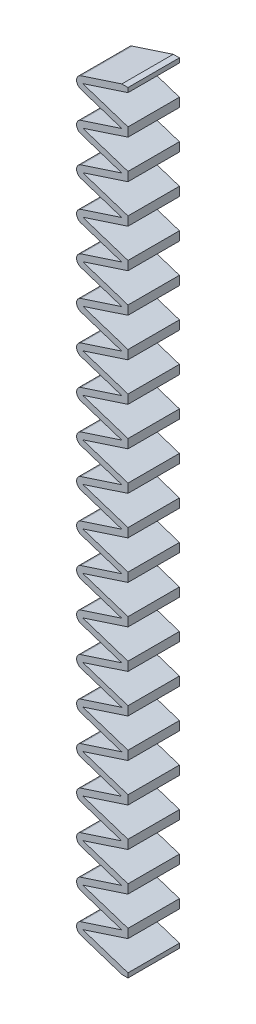
from build123d import *

# Parameters (mm, degrees)
BOSS_EXTRUDE1_DEPTH = 10


with BuildPart() as part:
    # Sketch1 → Boss-Extrude1 (new body)
    with BuildSketch(Plane.XY):
        with BuildLine():
            Line((5, 74.130107274), (5, 75))
            Line((5, 75), (3.8, 75))
            Line((3.8, 75), (-4.17325943, 72.390472445))
            ThreePointArc((-4.17325943, 72.390472445), (-5, 71.25), (-4.17325943, 70.109527555))
            Line((-4.17325943, 70.109527555), (3.8, 67.5))
            Line((3.8, 67.5), (-4.17325943, 64.890472445))
            ThreePointArc((-4.17325943, 64.890472445), (-5, 63.75), (-4.17325943, 62.609527555))
            Line((-4.17325943, 62.609527555), (3.8, 60))
            Line((3.8, 60), (-4.17325943, 57.390472445))
            ThreePointArc((-4.17325943, 57.390472445), (-5, 56.25), (-4.17325943, 55.109527555))
            Line((-4.17325943, 55.109527555), (3.8, 52.5))
            Line((3.8, 52.5), (-4.17325943, 49.890472445))
            ThreePointArc((-4.17325943, 49.890472445), (-5, 48.75), (-4.17325943, 47.609527555))
            Line((-4.17325943, 47.609527555), (3.8, 45))
            Line((3.8, 45), (-4.17325943, 42.390472445))
            ThreePointArc((-4.17325943, 42.390472445), (-5, 41.25), (-4.17325943, 40.109527555))
            Line((-4.17325943, 40.109527555), (3.8, 37.5))
            Line((3.8, 37.5), (-4.17325943, 34.890472445))
            ThreePointArc((-4.17325943, 34.890472445), (-5, 33.75), (-4.17325943, 32.609527555))
            Line((-4.17325943, 32.609527555), (3.8, 30))
            Line((3.8, 30), (-4.17325943, 27.390472445))
            ThreePointArc((-4.17325943, 27.390472445), (-5, 26.25), (-4.17325943, 25.109527555))
            Line((-4.17325943, 25.109527555), (3.8, 22.5))
            Line((3.8, 22.5), (-4.17325943, 19.890472445))
            ThreePointArc((-4.17325943, 19.890472445), (-5, 18.75), (-4.17325943, 17.609527555))
            Line((-4.17325943, 17.609527555), (3.8, 15))
            Line((3.8, 15), (-4.17325943, 12.390472445))
            ThreePointArc((-4.17325943, 12.390472445), (-5, 11.25), (-4.17325943, 10.109527555))
            Line((-4.17325943, 10.109527555), (3.8, 7.5))
            Line((3.8, 7.5), (-4.17325943, 4.890472445))
            ThreePointArc((-4.17325943, 4.890472445), (-5, 3.75), (-4.17325943, 2.609527555))
            Line((-4.17325943, 2.609527555), (3.8, 0))
            Line((3.8, 0), (-4.17325943, -2.609527555))
            ThreePointArc((-4.17325943, -2.609527555), (-5, -3.75), (-4.17325943, -4.890472445))
            Line((-4.17325943, -4.890472445), (3.8, -7.5))
            Line((3.8, -7.5), (-4.17325943, -10.109527555))
            ThreePointArc((-4.17325943, -10.109527555), (-5, -11.25), (-4.17325943, -12.390472445))
            Line((-4.17325943, -12.390472445), (3.8, -15))
            Line((3.8, -15), (-4.17325943, -17.609527555))
            ThreePointArc((-4.17325943, -17.609527555), (-5, -18.75), (-4.17325943, -19.890472445))
            Line((-4.17325943, -19.890472445), (3.8, -22.5))
            Line((3.8, -22.5), (-4.17325943, -25.109527555))
            ThreePointArc((-4.17325943, -25.109527555), (-5, -26.25), (-4.17325943, -27.390472445))
            Line((-4.17325943, -27.390472445), (3.8, -30))
            Line((3.8, -30), (-4.17325943, -32.609527555))
            ThreePointArc((-4.17325943, -32.609527555), (-5, -33.75), (-4.17325943, -34.890472445))
            Line((-4.17325943, -34.890472445), (3.8, -37.5))
            Line((3.8, -37.5), (-4.17325943, -40.109527555))
            ThreePointArc((-4.17325943, -40.109527555), (-5, -41.25), (-4.17325943, -42.390472445))
            Line((-4.17325943, -42.390472445), (3.8, -45))
            Line((3.8, -45), (-4.17325943, -47.609527555))
            ThreePointArc((-4.17325943, -47.609527555), (-5, -48.75), (-4.17325943, -49.890472445))
            Line((-4.17325943, -49.890472445), (3.8, -52.5))
            Line((3.8, -52.5), (-4.17325943, -55.109527555))
            ThreePointArc((-4.17325943, -55.109527555), (-5, -56.25), (-4.17325943, -57.390472445))
            Line((-4.17325943, -57.390472445), (3.8, -60))
            Line((3.8, -60), (-4.17325943, -62.609527555))
            ThreePointArc((-4.17325943, -62.609527555), (-5, -63.75), (-4.17325943, -64.890472445))
            Line((-4.17325943, -64.890472445), (3.8, -67.5))
            Line((3.8, -67.5), (-4.17325943, -70.109527555))
            ThreePointArc((-4.17325943, -70.109527555), (-5, -71.25), (-4.17325943, -72.390472445))
            Line((-4.17325943, -72.390472445), (3.8, -75))
            Line((3.8, -75), (5, -75))
            Line((5, -75), (5, -74.130107274))
            Line((5, -74.130107274), (-3.8, -71.25))
            Line((-3.8, -71.25), (5, -68.369892726))
            Line((5, -68.369892726), (5, -67.5))
            Line((5, -67.5), (5, -66.630107274))
            Line((5, -66.630107274), (-3.8, -63.75))
            Line((-3.8, -63.75), (5, -60.869892726))
            Line((5, -60.869892726), (5, -60))
            Line((5, -60), (5, -59.130107274))
            Line((5, -59.130107274), (-3.8, -56.25))
            Line((-3.8, -56.25), (5, -53.369892726))
            Line((5, -53.369892726), (5, -52.5))
            Line((5, -52.5), (5, -51.630107274))
            Line((5, -51.630107274), (-3.8, -48.75))
            Line((-3.8, -48.75), (5, -45.869892726))
            Line((5, -45.869892726), (5, -45))
            Line((5, -45), (5, -44.130107274))
            Line((5, -44.130107274), (-3.8, -41.25))
            Line((-3.8, -41.25), (5, -38.369892726))
            Line((5, -38.369892726), (5, -37.5))
            Line((5, -37.5), (5, -36.630107274))
            Line((5, -36.630107274), (-3.8, -33.75))
            Line((-3.8, -33.75), (5, -30.869892726))
            Line((5, -30.869892726), (5, -30))
            Line((5, -30), (5, -29.130107274))
            Line((5, -29.130107274), (-3.8, -26.25))
            Line((-3.8, -26.25), (5, -23.369892726))
            Line((5, -23.369892726), (5, -22.5))
            Line((5, -22.5), (5, -21.630107274))
            Line((5, -21.630107274), (-3.8, -18.75))
            Line((-3.8, -18.75), (5, -15.869892726))
            Line((5, -15.869892726), (5, -15))
            Line((5, -15), (5, -14.130107274))
            Line((5, -14.130107274), (-3.8, -11.25))
            Line((-3.8, -11.25), (5, -8.369892726))
            Line((5, -8.369892726), (5, -7.5))
            Line((5, -7.5), (5, -6.630107274))
            Line((5, -6.630107274), (-3.8, -3.75))
            Line((-3.8, -3.75), (5, -0.869892726))
            Line((5, -0.869892726), (5, 0))
            Line((5, 0), (5, 0.869892726))
            Line((5, 0.869892726), (-3.8, 3.75))
            Line((-3.8, 3.75), (5, 6.630107274))
            Line((5, 6.630107274), (5, 7.5))
            Line((5, 7.5), (5, 8.369892726))
            Line((5, 8.369892726), (-3.8, 11.25))
            Line((-3.8, 11.25), (5, 14.130107274))
            Line((5, 14.130107274), (5, 15))
            Line((5, 15), (5, 15.869892726))
            Line((5, 15.869892726), (-3.8, 18.75))
            Line((-3.8, 18.75), (5, 21.630107274))
            Line((5, 21.630107274), (5, 22.5))
            Line((5, 22.5), (5, 23.369892726))
            Line((5, 23.369892726), (-3.8, 26.25))
            Line((-3.8, 26.25), (5, 29.130107274))
            Line((5, 29.130107274), (5, 30))
            Line((5, 30), (5, 30.869892726))
            Line((5, 30.869892726), (-3.8, 33.75))
            Line((-3.8, 33.75), (5, 36.630107274))
            Line((5, 36.630107274), (5, 37.5))
            Line((5, 37.5), (5, 38.369892726))
            Line((5, 38.369892726), (-3.8, 41.25))
            Line((-3.8, 41.25), (5, 44.130107274))
            Line((5, 44.130107274), (5, 45))
            Line((5, 45), (5, 45.869892726))
            Line((5, 45.869892726), (-3.8, 48.75))
            Line((-3.8, 48.75), (5, 51.630107274))
            Line((5, 51.630107274), (5, 52.5))
            Line((5, 52.5), (5, 53.369892726))
            Line((5, 53.369892726), (-3.8, 56.25))
            Line((-3.8, 56.25), (5, 59.130107274))
            Line((5, 59.130107274), (5, 60))
            Line((5, 60), (5, 60.869892726))
            Line((5, 60.869892726), (-3.8, 63.75))
            Line((-3.8, 63.75), (5, 66.630107274))
            Line((5, 66.630107274), (5, 67.5))
            Line((5, 67.5), (5, 68.369892726))
            Line((5, 68.369892726), (-3.8, 71.25))
            Line((-3.8, 71.25), (5, 74.130107274))
        make_face()
    extrude(amount=BOSS_EXTRUDE1_DEPTH)


solid = part.part
